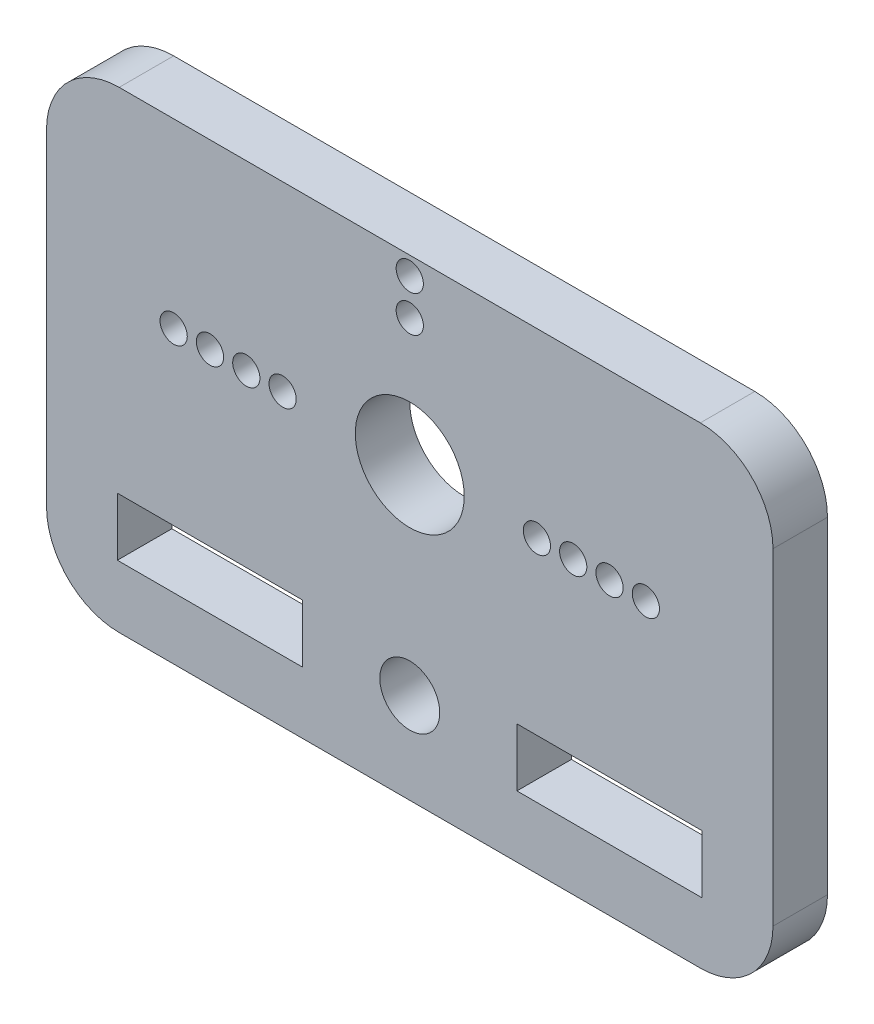
from build123d import *

# Parameters (mm, degrees)
ESKIZ_KONTUR_W        = 10.2
ESKIZ_KONTUR_H        = 3.2
PLASTINA_DEPTH        = 3
OTVERSTIYA_DEPTH      = 26.787593916
OTVERSTIYA_DEPTH_BACK = 26.787593916
ESKIZ_OTVERSTIYA_R    = 1.65
ESKIZ_OTVERSTIYA_R_2  = 0.75
ESKIZ_OTVERSTIYA_R_3  = 3


with BuildPart() as part:
    # Eskiz_kontur → Plastina (new body)
    with BuildSketch(Plane.XY):
        with BuildLine():
            Line((-20, -12), (-20, 6))
            ThreePointArc((-20, 6), (-18.828427125, 8.828427125), (-16, 10))
            Line((-16, 10), (16, 10))
            ThreePointArc((16, 10), (18.828427125, 8.828427125), (20, 6))
            Line((20, 6), (20, -12))
            ThreePointArc((20, -12), (18.828427125, -14.828427125), (16, -16))
            Line((16, -16), (-16, -16))
            ThreePointArc((-16, -16), (-18.828427125, -14.828427125), (-20, -12))
        make_face()
        with Locations((-11, -11)):
            Rectangle(ESKIZ_KONTUR_W, ESKIZ_KONTUR_H, mode=Mode.SUBTRACT)
        with Locations((11, -11)):
            Rectangle(ESKIZ_KONTUR_W, ESKIZ_KONTUR_H, mode=Mode.SUBTRACT)
    extrude(amount=PLASTINA_DEPTH)

    # Eskiz_otverstiya → Otverstiya (cut, two sides: drawn at the far end of the back side and taken through both)
    with BuildSketch(Plane.XY.offset(-OTVERSTIYA_DEPTH_BACK)):
        with Locations((0, -11)):
            Circle(ESKIZ_OTVERSTIYA_R)
        with Locations((-13, 0)):
            Circle(ESKIZ_OTVERSTIYA_R_2)
        with Locations((-11, 0)):
            Circle(ESKIZ_OTVERSTIYA_R_2)
        with Locations((-9, 0)):
            Circle(ESKIZ_OTVERSTIYA_R_2)
        with Locations((-7, 0)):
            Circle(ESKIZ_OTVERSTIYA_R_2)
        Circle(ESKIZ_OTVERSTIYA_R_3)
        with Locations((7, 0)):
            Circle(ESKIZ_OTVERSTIYA_R_2)
        with Locations((9, 0)):
            Circle(ESKIZ_OTVERSTIYA_R_2)
        with Locations((11, 0)):
            Circle(ESKIZ_OTVERSTIYA_R_2)
        with Locations((13, 0)):
            Circle(ESKIZ_OTVERSTIYA_R_2)
        with Locations((0, 7)):
            Circle(ESKIZ_OTVERSTIYA_R_2)
        with Locations((0, 9)):
            Circle(ESKIZ_OTVERSTIYA_R_2)
    extrude(amount=OTVERSTIYA_DEPTH + OTVERSTIYA_DEPTH_BACK, mode=Mode.SUBTRACT)


solid = part.part
